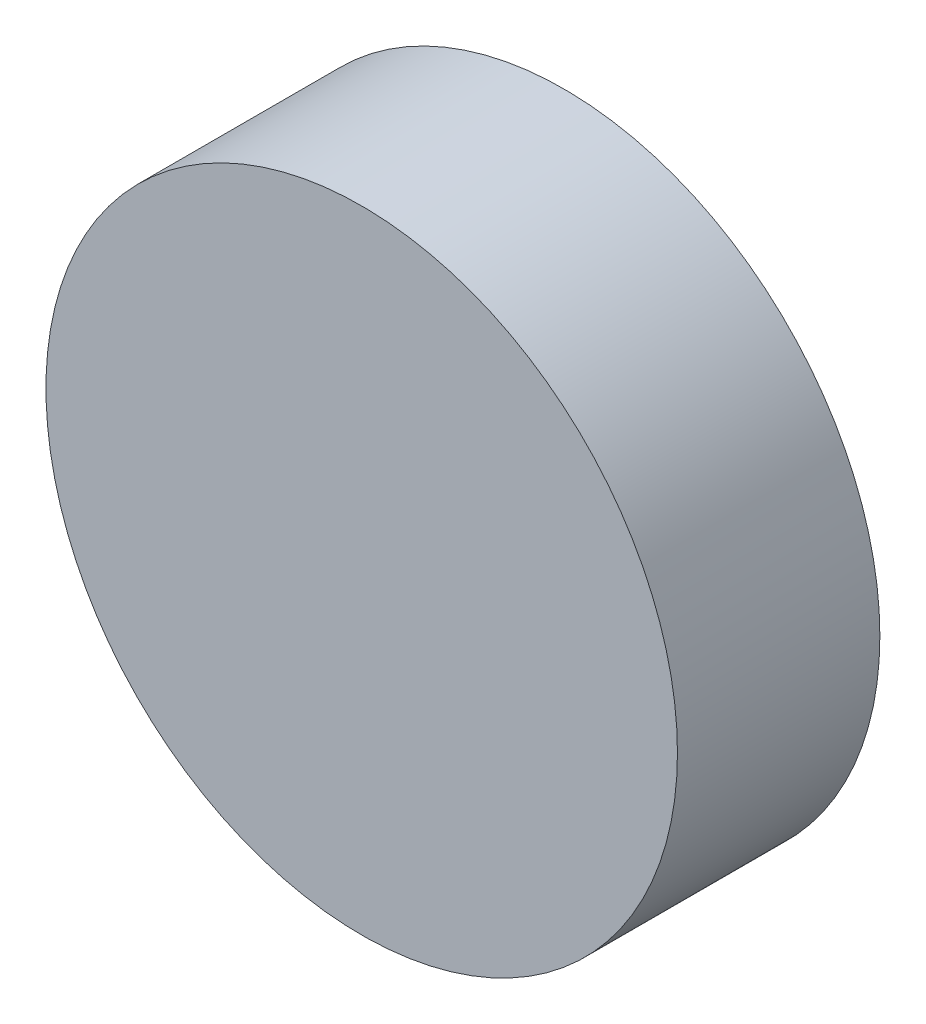
from build123d import *

# Parameters (mm, degrees)
CROQUIS1_R              = 31.2
SALIENTE_EXTRUIR1_DEPTH = 20


with BuildPart() as part:
    # Croquis1 → Saliente-Extruir1 (new body)
    with BuildSketch(Plane.XY):
        Circle(CROQUIS1_R)
    extrude(amount=SALIENTE_EXTRUIR1_DEPTH)


solid = part.part
